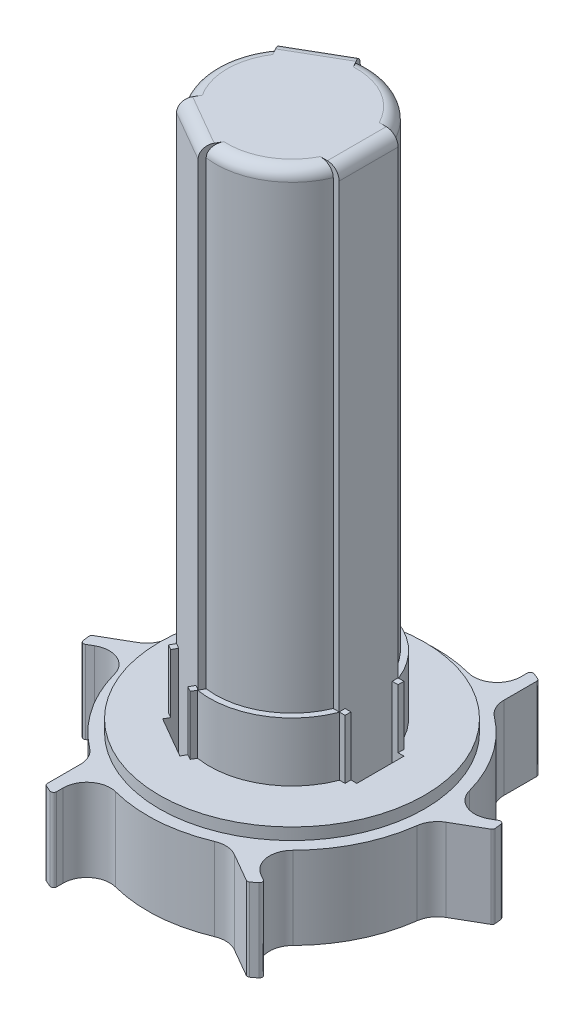
from build123d import *
from build123d.topology import SkipClean

# Parameters (mm, degrees)
BOSS_EXTRUDE1_DEPTH = 5
CIRPATTERN1_COUNT   = 3
BOSS_EXTRUDE2_START = 6
BOSS_EXTRUDE2_DEPTH = 14
FILLET1_R           = 4
FILLET2_R           = 0.5
SKETCH15_W          = 2
SKETCH15_H          = 8
CUT_EXTRUDE1_DEPTH  = 120.910149393
CIRPATTERN2_COUNT   = 3


with BuildPart() as part:
    # Sketch8 → Revolve1 (revolve)
    with BuildSketch(Plane.XY, mode=Mode.PRIVATE) as revolve1_sk:
        with BuildLine():
            Line((13, 32), (14, 32))
            Line((14, 32), (14, 22))
            Line((14, 22), (22.5, 22))
            Line((22.5, 22), (22.5, 20))
            Line((22.5, 20), (24.5, 20))
            Line((24.5, 20), (24.5, 6))
            Line((24.5, 6), (0, 6))
            Line((0, 6), (0, 112))
            Line((0, 112), (11, 112))
            ThreePointArc((11, 112), (12.414213562, 111.414213562), (13, 110))
            Line((13, 110), (13, 32))
        make_face()
    revolve(revolve1_sk.sketch.rotate(Axis((0, 22, 0), (0, 1, 0)), 90), axis=Axis((0, 22, 0), (0, 1, 0)))

    # Sketch9 → Boss-Extrude1 (add, symmetric)
    with BuildSketch(Plane.XY):
        with BuildLine():
            Line((13, 32), (14, 32))
            Line((14, 32), (14, 22))
            Line((14, 22), (0, 22))
            Line((0, 22), (0, 112))
            Line((0, 112), (11, 112))
            ThreePointArc((11, 112), (12.414213562, 111.414213562), (13, 110))
            Line((13, 110), (13, 32))
        make_face()
    boss_extrude1 = extrude(amount=BOSS_EXTRUDE1_DEPTH, both=True)

    # CirPattern1: Boss-Extrude1 ×3 about axis
    cirpattern1_axis = Axis((0, 0, 0), (0, 1, 0))
    for i in range(1, CIRPATTERN1_COUNT):
        add(boss_extrude1.rotate(cirpattern1_axis, i * 360 / CIRPATTERN1_COUNT))

    # Sketch13 → Boss-Extrude2 (add)
    with BuildSketch(Plane(origin=(0, 0, 0), x_dir=(1, 0, 0), z_dir=(0, 1, 0)).offset(BOSS_EXTRUDE2_START)):
        with BuildLine():
            Line((-24.473491319, -1.139395744), (-31.105691219, -4.968498142))
            ThreePointArc((-31.105691219, -4.968498142), (-31.258439449, -3.893579744), (-31.374053012, -2.814035819))
            Line((-31.374053012, -2.814035819), (-24.472006051, 1.170862852))
            ThreePointArc((-24.472006051, 1.170862852), (-24.499994937, 0.015751071), (-24.473491319, -1.139395744))
        make_face()
        with BuildLine():
            Line((13.223491319, -20.624967329), (19.855691219, -24.454069727))
            ThreePointArc((19.855691219, -24.454069727), (19.001158695, -25.123812773), (18.124053012, -25.763709019))
            Line((18.124053012, -25.763709019), (11.222006051, -21.778810348))
            ThreePointArc((11.222006051, -21.778810348), (12.236356641, -21.225493543), (13.223491319, -20.624967329))
        make_face()
        with BuildLine():
            Line((24.473491319, 1.139395744), (31.105691219, 4.968498142))
            ThreePointArc((31.105691219, 4.968498142), (31.258439449, 3.893579744), (31.374053012, 2.814035819))
            Line((31.374053012, 2.814035819), (24.472006051, -1.170862852))
            ThreePointArc((24.472006051, -1.170862852), (24.499994937, -0.015751071), (24.473491319, 1.139395744))
        make_face()
        with BuildLine():
            Line((11.25, 21.764363074), (11.25, 29.422567869))
            ThreePointArc((11.25, 29.422567869), (12.257280754, 29.017392517), (13.25, 28.577744838))
            Line((13.25, 28.577744838), (13.25, 20.607947496))
            ThreePointArc((13.25, 20.607947496), (12.263638296, 21.209742473), (11.25, 21.764363074))
        make_face()
        with BuildLine():
            Line((-13.223491319, 20.624967329), (-19.855691219, 24.454069727))
            ThreePointArc((-19.855691219, 24.454069727), (-19.001158695, 25.123812773), (-18.124053012, 25.763709019))
            Line((-18.124053012, 25.763709019), (-11.222006051, 21.778810348))
            ThreePointArc((-11.222006051, 21.778810348), (-12.236356641, 21.225493543), (-13.223491319, 20.624967329))
        make_face()
        with BuildLine():
            Line((-11.25, -21.764363074), (-11.25, -29.422567869))
            ThreePointArc((-11.25, -29.422567869), (-12.257280754, -29.017392517), (-13.25, -28.577744838))
            Line((-13.25, -28.577744838), (-13.25, -20.607947496))
            ThreePointArc((-13.25, -20.607947496), (-12.263638296, -21.209742473), (-11.25, -21.764363074))
        make_face()
    extrude(amount=BOSS_EXTRUDE2_DEPTH)

    # Fillet1
    fillet1_edges = [part.edges().sort_by_distance(p)[0] for p in [
        (-24.473491319, 13, 1.139395744),
        (-24.472006051, 13, -1.170862852),
        (-11.25, 13, 21.764363074),
        (-13.25, 13, 20.607947496),
        (-13.223491319, 13, -20.624967329),
        (-11.222006051, 13, -21.778810348),
        (11.25, 13, -21.764363074),
        (13.25, 13, -20.607947496),
        (24.473491319, 13, -1.139395744),
        (24.472006051, 13, 1.170862852),
        (13.223491319, 13, 20.624967329),
        (11.222006051, 13, 21.778810348),
    ]]
    fillet(fillet1_edges, radius=FILLET1_R)

    # Fillet2
    fillet2_edges = [part.edges().sort_by_distance(p)[0] for p in [
        (-31.374053012, 13, 2.814035819),
        (-31.105691219, 13, 4.968498142),
        (-13.25, 13, 28.577744838),
        (-11.25, 13, 29.422567869),
        (-18.124053012, 13, -25.763709019),
        (-19.855691219, 13, -24.454069727),
        (13.25, 13, -28.577744838),
        (11.25, 13, -29.422567869),
        (31.374053012, 13, -2.814035819),
        (31.105691219, 13, -4.968498142),
        (18.124053012, 13, 25.763709019),
        (19.855691219, 13, 24.454069727),
    ]]
    fillet(fillet2_edges, radius=FILLET2_R)

    # Sketch15 → Cut-Extrude1 (cut, through all)
    with BuildSketch(Plane(origin=(0, 0, 0), x_dir=(1, 0, 0), z_dir=(0, 1, 0))):
        with Locations((14, 0)):
            Rectangle(SKETCH15_W, SKETCH15_H)
    cut_extrude1 = extrude(amount=CUT_EXTRUDE1_DEPTH, mode=Mode.SUBTRACT)

    # CirPattern2: Cut-Extrude1 ×3 about axis
    cirpattern2_axis = Axis((0, 0, 0), (0, 1, 0))
    for i in range(1, CIRPATTERN2_COUNT):
        add(cut_extrude1.rotate(cirpattern2_axis, i * 360 / CIRPATTERN2_COUNT), mode=Mode.SUBTRACT)

    # Sketch16 → Cut-Revolve1 (revolve, cut)
    with SkipClean():  # the faces are left unmerged after this step: merging them gives an invalid solid
        with BuildSketch(Plane.XY, mode=Mode.PRIVATE) as cut_revolve1_sk:
            Polygon((11, 6), (14, 9), (17, 6), align=None)
        revolve(cut_revolve1_sk.sketch.rotate(Axis((0, 0, 0), (0, 1, 0)), 257.102728972), axis=Axis((0, 0, 0), (0, 1, 0)), mode=Mode.SUBTRACT)


solid = part.part
